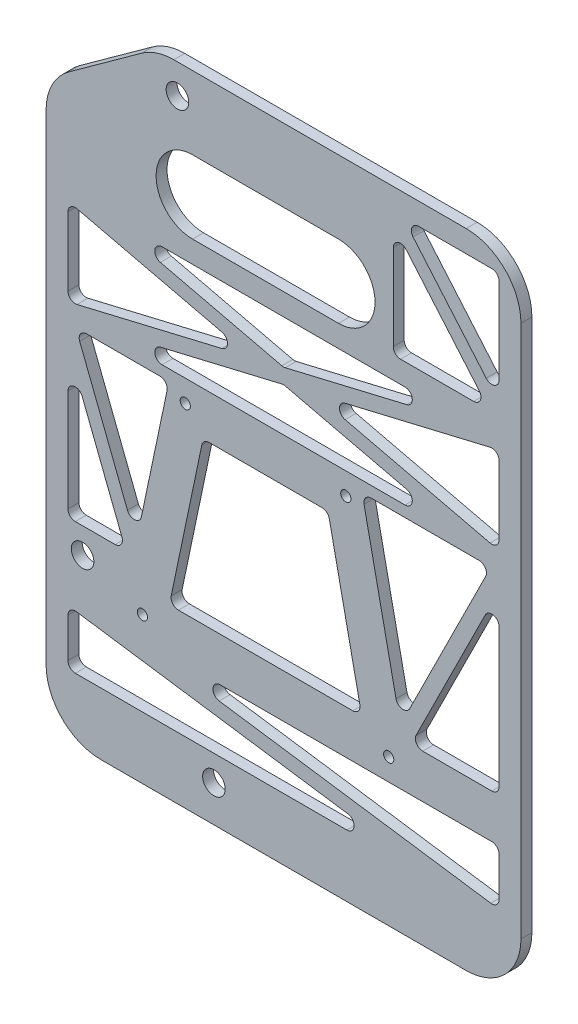
from build123d import *

# Parameters (mm, degrees)
SKETCH_1_R          = 3.1
SKETCH_1_R_2        = 1.4
EXTRUDE_1_DEPTH     = 3
FILLET_1_R          = 15
CUT_EXTRUDE_1_DEPTH = 10
FILLET_2_R          = 2


with BuildPart() as part:
    # 草图1 → 凸台-拉伸1 (new body)
    with BuildSketch(Plane.XY):
        Polygon((20.145101954, 130.106797695), (-10, 108.335377566), (-10, 0), (-10, -46), (36, -46), (120.145101954, -46), (120.145101954, 130.106797695), align=None)
        Circle(SKETCH_1_R, mode=Mode.SUBTRACT)
        with Locations((26, 122)):
            Circle(SKETCH_1_R, mode=Mode.SUBTRACT)
        with Locations((36, -36)):
            Circle(SKETCH_1_R, mode=Mode.SUBTRACT)
        with Locations((28.145101954, 50.106797695)):
            Circle(SKETCH_1_R_2, mode=Mode.SUBTRACT)
        with Locations((72.145101954, 50.106797695)):
            Circle(SKETCH_1_R_2, mode=Mode.SUBTRACT)
        with Locations((16.395101954, -5.893202305)):
            Circle(SKETCH_1_R_2, mode=Mode.SUBTRACT)
        with Locations((83.895101954, -5.893202305)):
            Circle(SKETCH_1_R_2, mode=Mode.SUBTRACT)
        with BuildLine():
            Line((30.145101954, 110.106797695), (70.145101954, 110.106797695))
            ThreePointArc((70.145101954, 110.106797695), (80.145101954, 100.106797695), (70.145101954, 90.106797695))
            Line((70.145101954, 90.106797695), (30.145101954, 90.106797695))
            ThreePointArc((30.145101954, 90.106797695), (20.145101954, 100.106797695), (30.145101954, 110.106797695))
        make_face(mode=Mode.SUBTRACT)
    extrude(amount=EXTRUDE_1_DEPTH)

    # 圆角1
    fillet_1_edges = [part.edges().sort_by_distance(p)[0] for p in [
        (-10, -46, 1.5),
        (-10, 108.335377566, 1.5),
        (20.145101954, 130.106797695, 1.5),
        (120.145101954, 130.106797695, 1.5),
        (120.145101954, -46, 1.5),
    ]]
    fillet(fillet_1_edges, radius=FILLET_1_R)

    # 草图2 → 切除-拉伸1 (cut)
    with BuildSketch(Plane.XY.offset(3)):
        Polygon((9.95669343, -11.893202305), (114.145101954, -26.979143214), (114.145101954, -11.893202305), align=None)
        Polygon((-4, -13.914059091), (-4, -29), (100.188408524, -29), align=None)
        Polygon((23.784683113, 0.106797695), (33.01682597, 44.106797695), (67.273377938, 44.106797695), (76.505520795, 0.106797695), align=None)
        Polygon((14.742218034, 10.577914397), (23.665689084, 53.106797695), (-1.853126388, 53.106797695), align=None)
        Polygon((-4, 7), (11.844621313, 7), (-4, 47.605005448), align=None)
        Polygon((111.910718161, 53.106797695), (76.624514825, 53.106797695), (87.082812907, 3.262994069), align=None)
        Polygon((114.145101954, 0.106797695), (114.145101954, 48.621111695), (89.979434332, 0.106797695), align=None)
        Polygon((-4, 82.051397551), (-4, 58.16219784), (46.39985599, 70.106797695), align=None)
        Polygon((4.672694987, 84.106797695), (55.072550977, 72.16219784), (105.472406967, 84.106797695), align=None)
        Polygon((114.145101954, 82.051397551), (63.745245965, 70.106797695), (114.145101954, 58.16219784), align=None)
        Polygon((55.072550977, 68.051397551), (4.672694987, 56.106797695), (105.472406967, 56.106797695), align=None)
        Polygon((87.773796421, 124.106797695), (114.145101954, 93.188715346), (114.145101954, 124.106797695), align=None)
        Polygon((85.145101954, 121.024880044), (85.145101954, 90.106797695), (111.516407487, 90.106797695), align=None)
    extrude(amount=-CUT_EXTRUDE_1_DEPTH, mode=Mode.SUBTRACT)

    # 圆角2
    fillet_2_edges = [part.edges().sort_by_distance(p)[0] for p in [
        (-4, 58.16219784, 1.5),
        (-4, 82.051397551, 1.5),
        (46.39985599, 70.106797695, 1.5),
        (55.072550977, 72.16219784, 1.5),
        (4.672694987, 84.106797695, 1.5),
        (105.472406967, 84.106797695, 1.5),
        (111.910718161, 53.106797695, 1.5),
        (87.082812907, 3.262994069, 1.5),
        (76.624514825, 53.106797695, 1.5),
        (114.145101954, 48.621111695, 1.5),
        (114.145101954, 0.106797695, 1.5),
        (89.979434332, 0.106797695, 1.5),
        (-4, -13.914059091, 1.5),
        (100.188408524, -29, 1.5),
        (-4, -29, 1.5),
        (23.784683113, 0.106797695, 1.5),
        (33.01682597, 44.106797695, 1.5),
        (67.273377938, 44.106797695, 1.5),
        (76.505520795, 0.106797695, 1.5),
        (-4, 47.605005448, 1.5),
        (11.844621313, 7, 1.5),
        (-4, 7, 1.5),
        (-1.853126388, 53.106797695, 1.5),
        (23.665689084, 53.106797695, 1.5),
        (14.742218034, 10.577914397, 1.5),
        (4.672694987, 56.106797695, 1.5),
        (55.072550977, 68.051397551, 1.5),
        (105.472406967, 56.106797695, 1.5),
        (63.745245965, 70.106797695, 1.5),
        (114.145101954, 82.051397551, 1.5),
        (114.145101954, 58.16219784, 1.5),
        (85.145101954, 121.024880044, 1.5),
        (111.516407487, 90.106797695, 1.5),
        (85.145101954, 90.106797695, 1.5),
        (87.773796421, 124.106797695, 1.5),
        (114.145101954, 124.106797695, 1.5),
        (114.145101954, 93.188715346, 1.5),
        (9.95669343, -11.893202305, 1.5),
        (114.145101954, -11.893202305, 1.5),
        (114.145101954, -26.979143214, 1.5),
    ]]
    fillet(fillet_2_edges, radius=FILLET_2_R)


solid = part.part
